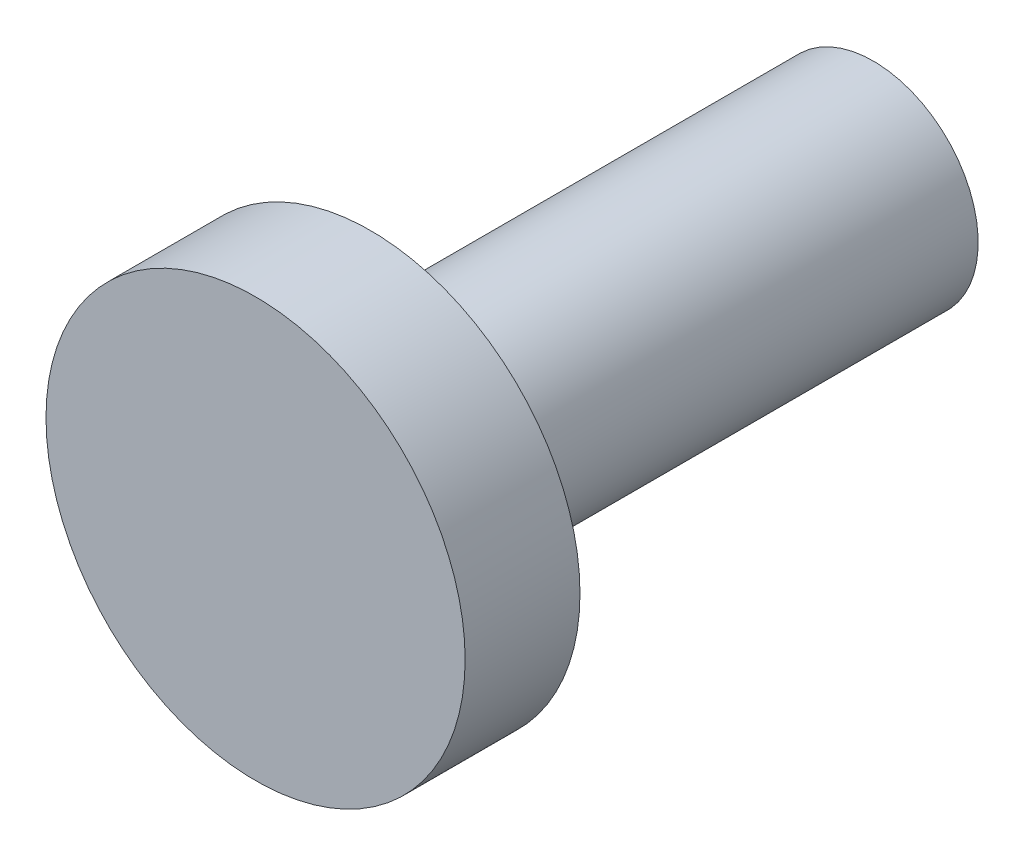
from build123d import *

# Parameters (mm, degrees)
ESQUISSE1_R        = 2.5
BOSS_EXTRU_1_DEPTH = 1.37
ESQUISSE2_R        = 1.25
BOSS_EXTRU_2_DEPTH = 6


with BuildPart() as part:
    # Esquisse1 → Boss.-Extru.1 (new body)
    with BuildSketch(Plane.XY):
        Circle(ESQUISSE1_R)
    extrude(amount=BOSS_EXTRU_1_DEPTH)

    # Esquisse2 → Boss.-Extru.2 (add)
    with BuildSketch(Plane(origin=(0, 0, 0), x_dir=(-1, 0, 0), z_dir=(0, 0, -1))):
        Circle(ESQUISSE2_R)
    extrude(amount=BOSS_EXTRU_2_DEPTH)


solid = part.part
